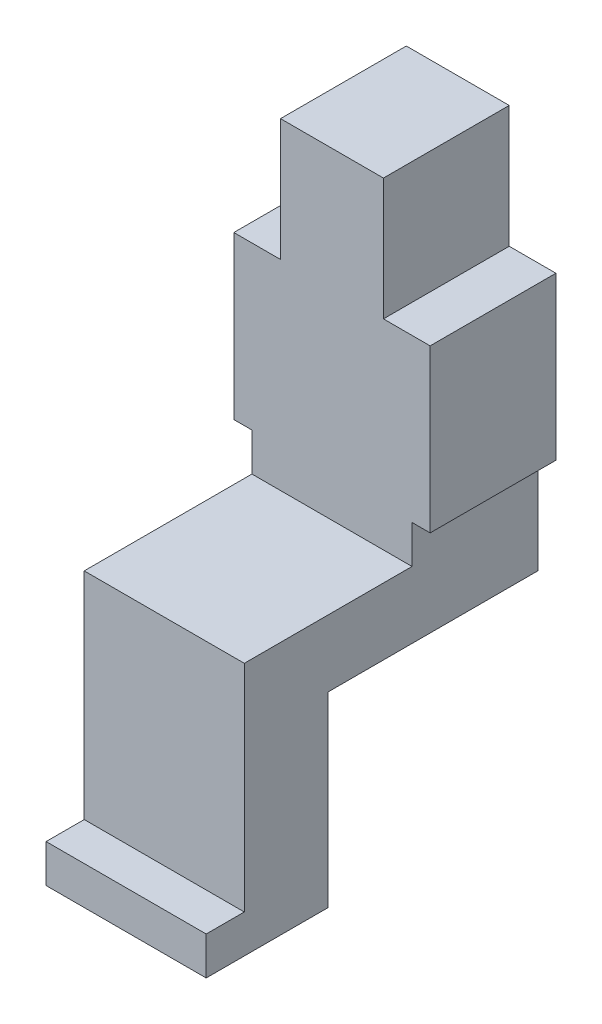
from build123d import *

# Parameters (mm, degrees)
BOSS_EXTRUDE1_DEPTH = 210
SKETCH3_W           = 270
SKETCH3_H           = 330
BOSS_EXTRUDE2_DEPTH = 320
SKETCH4_W           = 330
SKETCH4_H           = 425
BOSS_EXTRUDE3_DEPTH = 257.5
SKETCH5_W           = 420
SKETCH5_H           = 220
BOSS_EXTRUDE4_DEPTH = 490
SKETCH6_W           = 420
SKETCH6_H           = 100
BOSS_EXTRUDE5_DEPTH = 100


with BuildPart() as part:
    # Sketch2 → Boss-Extrude1 (new, symmetric)
    with BuildSketch(Plane(origin=(0, 0, 0), x_dir=(0, 0, -1), z_dir=(1, 0, 0))):
        Polygon((-560, -130), (210, -130), (210, 570), (-120, 570), (-120, 45), (-560, 45), align=None)
    extrude(amount=BOSS_EXTRUDE1_DEPTH, both=True)

    # Sketch3 → Boss-Extrude2 (add)
    with BuildSketch(Plane(origin=(0, 570, 0), x_dir=(1, 0, 0), z_dir=(0, 1, 0))):
        with Locations((0, 45)):
            Rectangle(SKETCH3_W, SKETCH3_H)
    extrude(amount=BOSS_EXTRUDE2_DEPTH)

    # Sketch4 → Boss-Extrude3 (add, symmetric)
    with BuildSketch(Plane(origin=(0, 0, 0), x_dir=(0, 0, -1), z_dir=(1, 0, 0))):
        with Locations((45, 357.5)):
            Rectangle(SKETCH4_W, SKETCH4_H)
    extrude(amount=BOSS_EXTRUDE3_DEPTH, both=True)

    # Sketch5 → Boss-Extrude4 (add)
    with BuildSketch(Plane.XZ.offset(130)):
        with Locations((0, 450)):
            Rectangle(SKETCH5_W, SKETCH5_H)
    extrude(amount=BOSS_EXTRUDE4_DEPTH)

    # Sketch6 → Boss-Extrude5 (add)
    with BuildSketch(Plane.XY.offset(560)):
        with Locations((0, -570)):
            Rectangle(SKETCH6_W, SKETCH6_H)
    extrude(amount=BOSS_EXTRUDE5_DEPTH)


solid = part.part
